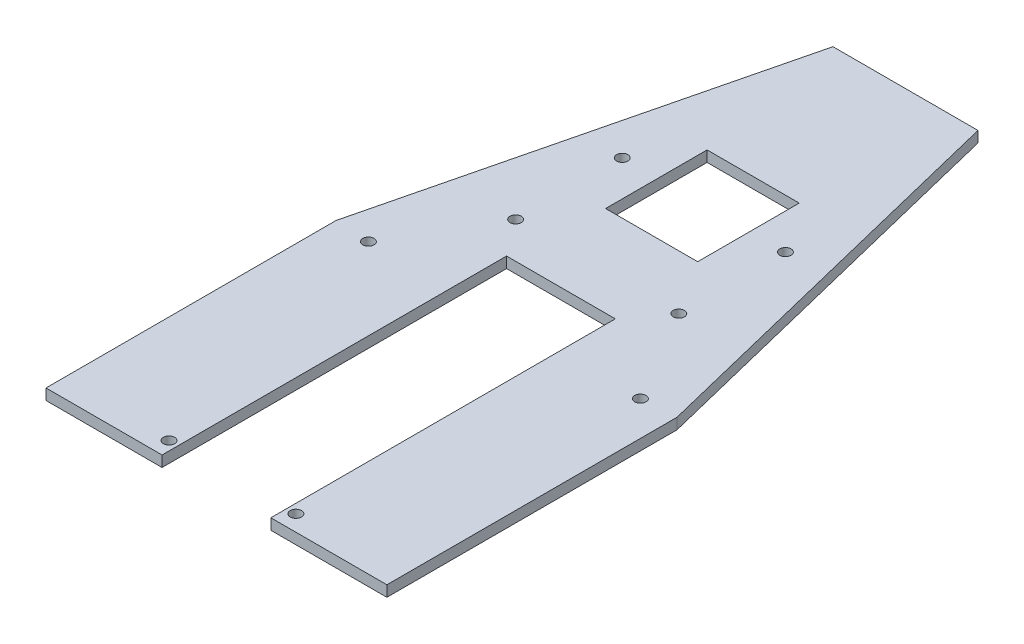
from build123d import *

# Parameters (mm, degrees)
BODY_DEPTH             = 3
SKETCH5_W              = 25.4
SKETCH5_H              = 28
PROTOBOARD_MOUNT_DEPTH = 10
SKETCH8_R              = 1.55
STAND_OFF_MOUNT_DEPTH  = 10
SKETCH9_R              = 1.55
PHONE_MOUNT_DEPTH      = 10


with BuildPart() as part:
    # Sketch3 → Body (new body)
    with BuildSketch(Plane(origin=(0, 0, 0), x_dir=(1, 0, 0), z_dir=(0, 1, 0))):
        Polygon((-15, -95), (-47, -95), (-47, -15), (-20, 95), (20, 95), (47, -15), (47, -95), (15, -95), (15, 0), (-15, 0), align=None)
    extrude(amount=BODY_DEPTH)

    # Sketch5 → Protoboard Mount (cut)
    with BuildSketch(Plane(origin=(0, 3, 0), x_dir=(1, 0, 0), z_dir=(0, 1, 0))):
        with Locations((0, 39)):
            Rectangle(SKETCH5_W, SKETCH5_H)
    extrude(amount=-PROTOBOARD_MOUNT_DEPTH, mode=Mode.SUBTRACT)

    # Sketch8 → Stand Off Mount (cut)
    with BuildSketch(Plane(origin=(0, 3, 0), x_dir=(1, 0, 0), z_dir=(0, 1, 0))):
        with Locations(Location((-22.5, 39.4, 0), (0, 0, 270))):
            Circle(SKETCH8_R)
        with Locations(Location((22.5, 39.4, 0), (0, 0, 270))):
            Circle(SKETCH8_R)
        with Locations(Location((37.5, -15.6, 0), (0, 0, 270))):
            Circle(SKETCH8_R)
        with Locations(Location((-37.5, -15.6, 0), (0, 0, 270))):
            Circle(SKETCH8_R)
        with Locations(Location((-17.5, -90.6, 0), (0, 0, 270))):
            Circle(SKETCH8_R)
        with Locations(Location((17.5, -90.6, 0), (0, 0, 270))):
            Circle(SKETCH8_R)
    extrude(amount=-STAND_OFF_MOUNT_DEPTH, mode=Mode.SUBTRACT)

    # Sketch9 → Phone Mount (cut)
    with BuildSketch(Plane(origin=(0, 3, 0), x_dir=(1, 0, 0), z_dir=(0, 1, 0))):
        with Locations(Location((-22.5, 10, 0), (0, 0, 270))):
            Circle(SKETCH9_R)
        with Locations(Location((22.5, 10, 0), (0, 0, 270))):
            Circle(SKETCH9_R)
    extrude(amount=-PHONE_MOUNT_DEPTH, mode=Mode.SUBTRACT)


solid = part.part
